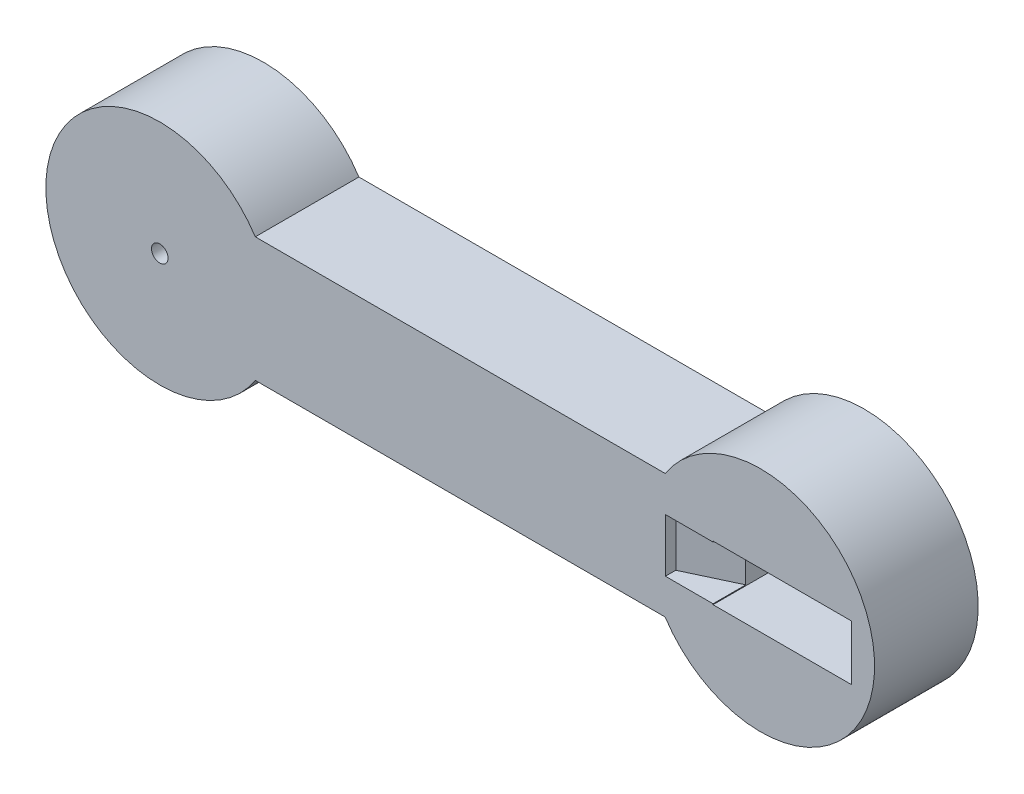
from build123d import *

# Parameters (mm, degrees)
BOSS_EXTRUDE1_DEPTH = 25
SKETCH16_W          = 33.4
SKETCH16_H          = 13.3
CUT_EXTRUDE10_DEPTH = 4.5
SKETCH19_R          = 20
CUT_EXTRUDE14_DEPTH = 5
SKETCH17_W          = 24.4
SKETCH17_H          = 13.3
CUT_EXTRUDE11_DEPTH = 177.45821035
CUT_EXTRUDE13_DEPTH = 6.45
SKETCH20_W          = 33.4
SKETCH20_H          = 13.3
CUT_EXTRUDE15_DEPTH = 176.655202029
SKETCH21_R          = 1.1
CUT_EXTRUDE16_DEPTH = 177.45821035
SKETCH22_R          = 2
CUT_EXTRUDE17_DEPTH = 20


with BuildPart() as part:
    # Sketch1 → Boss-Extrude1 (new body)
    with BuildSketch(Plane.XY):
        with BuildLine():
            ThreePointArc((172.5, 0), (152.823244805, 26.363741023), (121.951138857, 15))
            Line((121.951138857, 15), (145, 15))
            Line((145, 15), (145, -15))
            Line((145, -15), (121.951138857, -15))
            ThreePointArc((121.951138857, -15), (152.823244805, -26.363741023), (172.5, 0))
        make_face()
        with BuildLine():
            Line((145, 15), (121.951138857, 15))
            ThreePointArc((121.951138857, 15), (117.5, 0), (121.951138857, -15))
            Line((121.951138857, -15), (145, -15))
            Line((145, -15), (145, 15))
        make_face()
        with BuildLine():
            Line((121.951138857, 15), (23.048861143, 15))
            ThreePointArc((23.048861143, 15), (26.363741023, 7.823244805), (27.5, 0))
            ThreePointArc((27.5, 0), (26.363741023, -7.823244805), (23.048861143, -15))
            Line((23.048861143, -15), (121.951138857, -15))
            ThreePointArc((121.951138857, -15), (117.5, 0), (121.951138857, 15))
        make_face()
        with BuildLine():
            ThreePointArc((13.228756555, -15), (-20, 0), (13.228756555, 15))
            Line((13.228756555, 15), (23.048861143, 15))
            ThreePointArc((23.048861143, 15), (-27.5, 0), (23.048861143, -15))
            Line((23.048861143, -15), (13.228756555, -15))
        make_face()
        with BuildLine():
            Line((23.048861143, 15), (13.228756555, 15))
            ThreePointArc((13.228756555, 15), (18.228756555, 8.228756555), (20, 0))
            ThreePointArc((20, 0), (18.228756555, -8.228756555), (13.228756555, -15))
            Line((13.228756555, -15), (23.048861143, -15))
            ThreePointArc((23.048861143, -15), (26.363741023, -7.823244805), (27.5, 0))
            ThreePointArc((27.5, 0), (26.363741023, 7.823244805), (23.048861143, 15))
        make_face()
        with BuildLine():
            Line((0, -15), (0, 15))
            Line((0, 15), (13.228756555, 15))
            ThreePointArc((13.228756555, 15), (-20, 0), (13.228756555, -15))
            Line((13.228756555, -15), (0, -15))
        make_face()
        with BuildLine():
            Line((13.228756555, 15), (0, 15))
            Line((0, 15), (0, -15))
            Line((0, -15), (13.228756555, -15))
            ThreePointArc((13.228756555, -15), (18.228756555, -8.228756555), (20, 0))
            ThreePointArc((20, 0), (18.228756555, 8.228756555), (13.228756555, 15))
        make_face()
    extrude(amount=BOSS_EXTRUDE1_DEPTH)

    # Sketch16 → Cut-Extrude10 (cut)
    with BuildSketch(Plane(origin=(0, 0, 0), x_dir=(-1, 0, 0), z_dir=(0, 0, -1))):
        with Locations((-150.21934279, 0)):
            Rectangle(SKETCH16_W, SKETCH16_H)
    extrude(amount=-CUT_EXTRUDE10_DEPTH, mode=Mode.SUBTRACT)

    # Sketch19 → Cut-Extrude14 (cut)
    with BuildSketch(Plane(origin=(0, 0, 0), x_dir=(-1, 0, 0), z_dir=(0, 0, -1))):
        Circle(SKETCH19_R)
    extrude(amount=-CUT_EXTRUDE14_DEPTH, mode=Mode.SUBTRACT)

    # Sketch17 → Cut-Extrude11 (cut, through all)
    with BuildSketch(Plane(origin=(0, 0, 0), x_dir=(-1, 0, 0), z_dir=(0, 0, -1))):
        with Locations((-150.21934279, 0)):
            Rectangle(SKETCH17_W, SKETCH17_H)
    extrude(amount=-CUT_EXTRUDE11_DEPTH, mode=Mode.SUBTRACT)

    # Sketch18 → Cut-Extrude13 (cut, symmetric)
    with BuildSketch(Plane(origin=(0, 0, 0), x_dir=(-1, 0, 0), z_dir=(0, -1, 0))):
        Polygon((-138.01934279, -15), (-138.01934279, -25), (-122.01934279, -25), (-122.01934279, -22.5), align=None)
    extrude(amount=CUT_EXTRUDE13_DEPTH, both=True, mode=Mode.SUBTRACT)

    # Sketch20 → Cut-Extrude15 (cut, through all)
    with BuildSketch(Plane(origin=(0, 0, 6.5), x_dir=(-1, 0, 0), z_dir=(0, 0, -1))):
        with Locations((-150.21934279, 0)):
            Rectangle(SKETCH20_W, SKETCH20_H)
    extrude(amount=-CUT_EXTRUDE15_DEPTH, mode=Mode.SUBTRACT)

    # Sketch21 → Cut-Extrude16 (cut, through all)
    with BuildSketch(Plane(origin=(0, 0, 0), x_dir=(-1, 0, 0), z_dir=(0, 0, -1))):
        with Locations((-164.249999957, 0)):
            Circle(SKETCH21_R)
        with Locations((-136.249999957, 0)):
            Circle(SKETCH21_R)
    extrude(amount=-CUT_EXTRUDE16_DEPTH, mode=Mode.SUBTRACT)

    # Sketch22 → Cut-Extrude17 (cut)
    with BuildSketch(Plane.XY.offset(25)):
        Circle(SKETCH22_R)
    extrude(amount=-CUT_EXTRUDE17_DEPTH, mode=Mode.SUBTRACT)


solid = part.part
